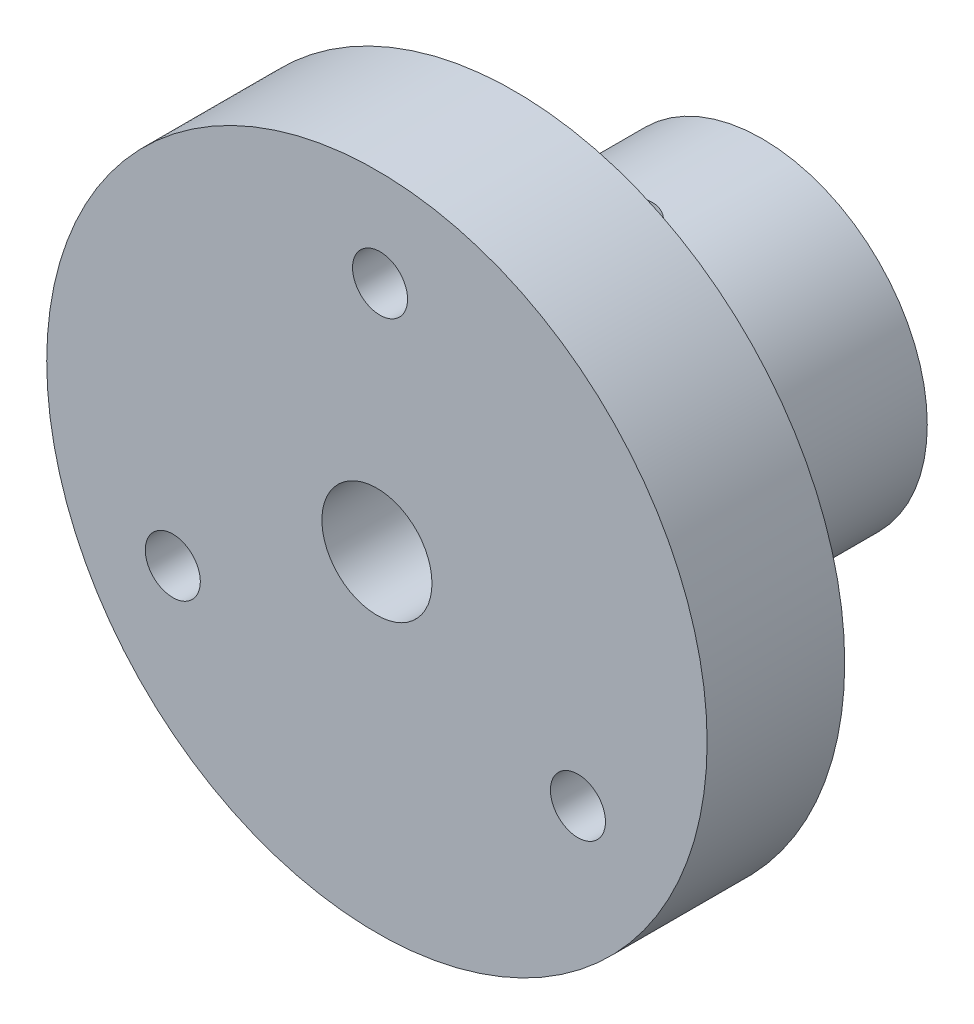
from build123d import *

# Parameters (mm, degrees)
SKETCH1_R           = 6
SKETCH1_R_2         = 2
BOSS_EXTRUDE1_DEPTH = 9
SKETCH2_R           = 12
SKETCH2_R_2         = 2
BOSS_EXTRUDE2_DEPTH = 5
SKETCH3_R           = 1
CUT_EXTRUDE1_DEPTH  = 7
SKETCH4_R           = 1
CUT_EXTRUDE2_DEPTH  = 5


with BuildPart() as part:
    # Sketch1 → Boss-Extrude1 (new body)
    with BuildSketch(Plane.XY):
        with Locations((-41.143471688, 10.161406423)):
            Circle(SKETCH1_R)
        with Locations((-41.143471688, 10.161406423)):
            Circle(SKETCH1_R_2, mode=Mode.SUBTRACT)
    extrude(amount=BOSS_EXTRUDE1_DEPTH)

    # Sketch2 → Boss-Extrude2 (add)
    with BuildSketch(Plane.XY.offset(9)):
        with Locations((-41.143471688, 10.161406423)):
            Circle(SKETCH2_R)
        with Locations((-41.143471688, 10.161406423)):
            Circle(SKETCH2_R_2, mode=Mode.SUBTRACT)
    extrude(amount=BOSS_EXTRUDE2_DEPTH)

    # Sketch3 → Cut-Extrude1 (cut)
    with BuildSketch(Plane(origin=(0, 17.811406423, 0), x_dir=(1, 0, 0), z_dir=(0, 1, 0))):
        with Locations(Location((-41.143471688, -5, 0), (0, 0, 180))):
            Circle(SKETCH3_R)
    extrude(amount=-CUT_EXTRUDE1_DEPTH, mode=Mode.SUBTRACT)

    # Sketch4 → Cut-Extrude2 (cut)
    with BuildSketch(Plane.XY.offset(14)):
        with Locations((-41.030441909, 18.661406423)):
            Circle(SKETCH4_R)
        with Locations((-33.838770645, 5.813519763)):
            Circle(SKETCH4_R)
        with Locations((-48.561202509, 6.009293083)):
            Circle(SKETCH4_R)
    extrude(amount=-CUT_EXTRUDE2_DEPTH, mode=Mode.SUBTRACT)


solid = part.part
